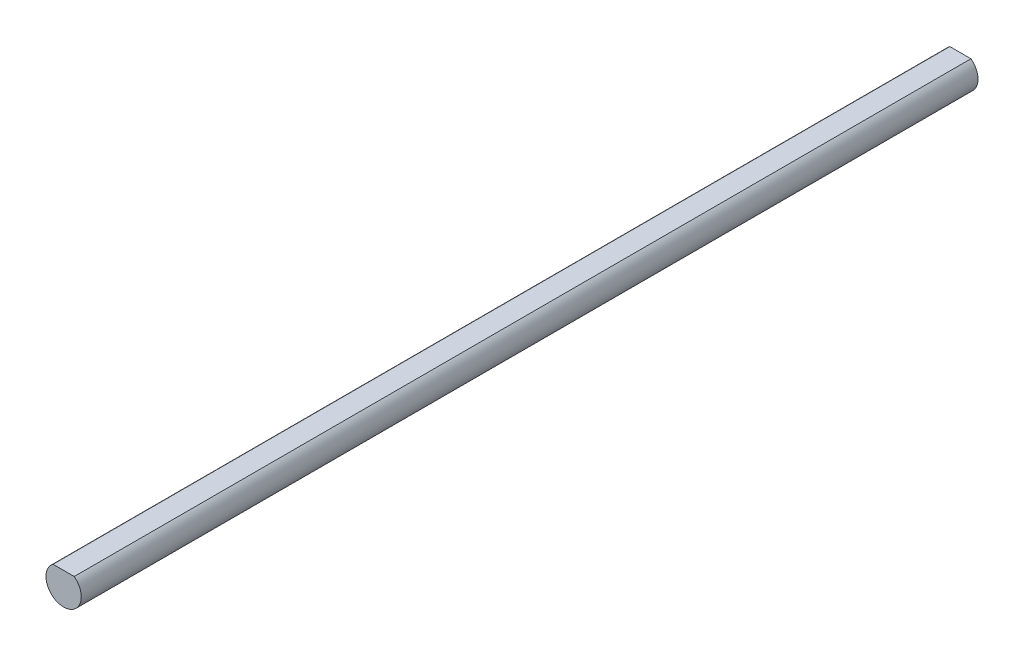
from build123d import *

# Parameters (mm, degrees)
BOSS_EXTRUDE1_DEPTH = 127


with BuildPart() as part:
    # Sketch1 → Boss-Extrude1 (new body)
    with BuildSketch(Plane.XY):
        with BuildLine():
            Line((-1.5, 2), (1.5, 2))
            ThreePointArc((1.5, 2), (0, -2.5), (-1.5, 2))
        make_face()
    extrude(amount=BOSS_EXTRUDE1_DEPTH)


solid = part.part
